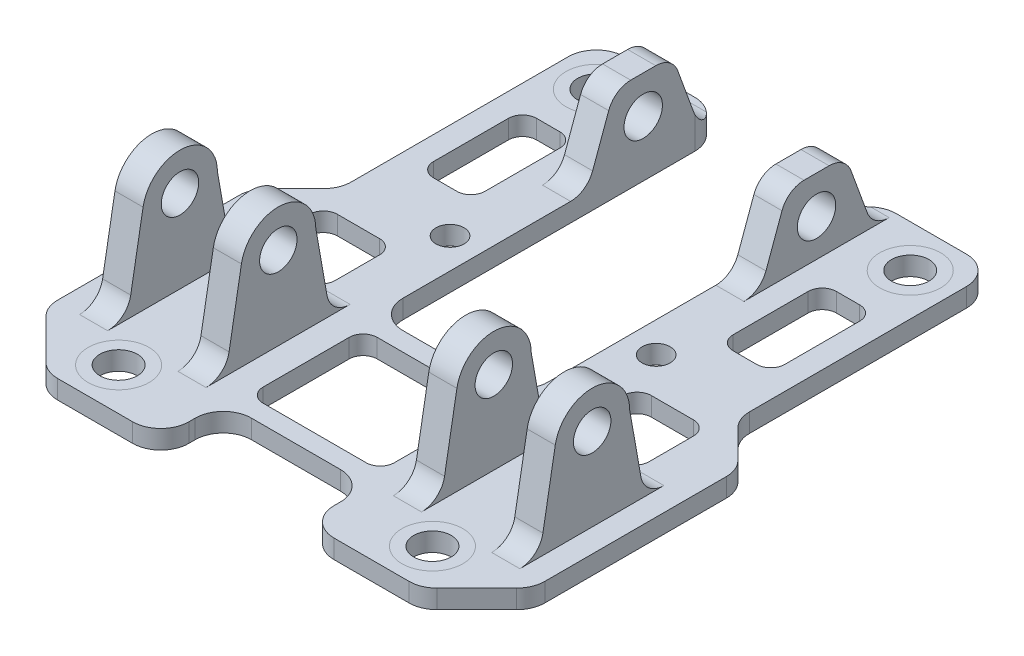
from build123d import *

# Parameters (mm, degrees)
BOSS_EXTRUDE1_DEPTH      = 52
BOSS_EXTRUDE1_DEPTH_BACK = 52
SKETCH1_W                = 120
SKETCH1_H                = 4
BOSS_EXTRUDE2_START      = -20
SKETCH1_3_R              = 4
BOSS_EXTRUDE2_DEPTH      = 6
LPATTERN1_COUNT          = 2
LPATTERN1_PITCH          = 21
BOSS_EXTRUDE3_START      = -15.5
SKETCH1_4_R              = 4.1
BOSS_EXTRUDE3_DEPTH      = 6
SKETCH2_R                = 4
SKETCH2_W                = 15.5
SKETCH2_H                = 74.282546786
SKETCH2_H_2              = 13.357231507
CUT_EXTRUDE1_DEPTH       = 96.858544882
MIRROR2_START            = -20
MIRROR2_COPY_1_SKETCH_R  = 4
MIRROR2_COPY_1_DEPTH     = 6
SKETCH4_R                = 3
CUT_EXTRUDE2_DEPTH       = 10
SKETCH5_W                = 15
SKETCH5_H                = 15.5
SKETCH5_W_2              = 11
SKETCH5_H_2              = 22
SKETCH5_W_3              = 28
SKETCH5_H_3              = 24.360221707
CUT_EXTRUDE3_DEPTH       = 10
FILLET1_R                = 6
FILLET2_R                = 3
FILLET3_R                = 5


with BuildPart() as part:
    # Sketch1 → Boss-Extrude1 (new, two sides: drawn at the far end of the back side and taken through both)
    with BuildSketch(Plane(origin=(0, 0, 0), x_dir=(0, 0, -1), z_dir=(1, 0, 0)).offset(-BOSS_EXTRUDE1_DEPTH_BACK)):
        with Locations((-16.322496103, -16.524005043)):
            Rectangle(SKETCH1_W, SKETCH1_H)
    extrude(amount=BOSS_EXTRUDE1_DEPTH + BOSS_EXTRUDE1_DEPTH_BACK)

    # Sketch1<3> → Boss-Extrude2 (add)
    with BuildSketch(Plane(origin=(0, 0, 0), x_dir=(0, 0, -1), z_dir=(1, 0, 0)).offset(BOSS_EXTRUDE2_START)):
        with BuildLine():
            Line((-54.601909319, 4.550530592), (-57.965264596, -14.524005043))
            Line((-57.965264596, -14.524005043), (-35.605042889, -14.524005043))
            Line((-35.605042889, -14.524005043), (-38.723447295, 3.161345171))
            ThreePointArc((-38.723447295, 3.161345171), (-46.026201353, 11.130902756), (-54.601909319, 4.550530592))
        make_face()
        with Locations((-46.723447295, 3.161345171)):
            Circle(SKETCH1_3_R, mode=Mode.SUBTRACT)
    boss_extrude2 = extrude(amount=-BOSS_EXTRUDE2_DEPTH)

    # LPattern1: Boss-Extrude2 ×2
    with Locations(*[(-i * LPATTERN1_PITCH, 0, 0) for i in range(1, LPATTERN1_COUNT)]):
        add(boss_extrude2)

    # Sketch1<4> → Boss-Extrude3 (add)
    with BuildSketch(Plane(origin=(0, 0, 0), x_dir=(0, 0, -1), z_dir=(1, 0, 0)).offset(BOSS_EXTRUDE3_START)):
        Polygon((14.677503897, -14.524005043), (20.501027646, 1.475994957), (32.853980149, 1.475994957), (38.677503897, -14.524005043), align=None)
        with Locations((26.677503897, -6.524005043)):
            Circle(SKETCH1_4_R, mode=Mode.SUBTRACT)
    boss_extrude3 = extrude(amount=-BOSS_EXTRUDE3_DEPTH)

    # Sketch2 → Cut-Extrude1 (cut, through all)
    with BuildSketch(Plane(origin=(0, -14.524005043, 0), x_dir=(1, 0, 0), z_dir=(0, 1, 0))):
        with Locations((-33.5, -67.322496103)):
            Circle(SKETCH2_R)
        with Locations((-33.5, 34.677503897)):
            Circle(SKETCH2_R)
        Polygon((-52, -76.322496103), (-40, -76.322496103), (-52, -64.322496103), align=None)
        Polygon((-42.5, 43.677503897), (-42.5, -11.105042889), (-52, -20.605042889), (-52, 43.677503897), align=None)
        with Locations((-7.75, 6.536230504)):
            Rectangle(SKETCH2_W, SKETCH2_H)
        with Locations((-7.75, -69.64388035)):
            Rectangle(SKETCH2_W, SKETCH2_H_2)
    cut_extrude1 = extrude(amount=-CUT_EXTRUDE1_DEPTH, mode=Mode.SUBTRACT)

    # Mirror2: Boss-Extrude2, Boss-Extrude3, Cut-Extrude1 across plane
    add(boss_extrude2.mirror(Plane(origin=(0, 0, 0), x_dir=(0, 0, 1), z_dir=(1, 0, 0))))
    add(boss_extrude3.mirror(Plane(origin=(0, 0, 0), x_dir=(0, 0, 1), z_dir=(1, 0, 0))))
    add(cut_extrude1.mirror(Plane(origin=(0, 0, 0), x_dir=(0, 0, 1), z_dir=(1, 0, 0))), mode=Mode.SUBTRACT)

    # Mirror2 copy 1 sketch → Mirror2 copy 1 (add)
    with BuildSketch(Plane(origin=(21, 0, 0), x_dir=(0, 0, -1), z_dir=(-1, 0, 0)).offset(MIRROR2_START)):
        with BuildLine():
            Line((-54.601909319, -4.550530592), (-57.965264596, 14.524005043))
            Line((-57.965264596, 14.524005043), (-35.605042889, 14.524005043))
            Line((-35.605042889, 14.524005043), (-38.723447295, -3.161345171))
            ThreePointArc((-38.723447295, -3.161345171), (-46.026201353, -11.130902756), (-54.601909319, -4.550530592))
        make_face()
        with Locations((-46.723447295, -3.161345171)):
            Circle(MIRROR2_COPY_1_SKETCH_R, mode=Mode.SUBTRACT)
    extrude(amount=-MIRROR2_COPY_1_DEPTH)

    # Sketch4 → Cut-Extrude2 (cut)
    with BuildSketch(Plane(origin=(0, -14.524005043, 0), x_dir=(1, 0, 0), z_dir=(0, 1, 0))):
        with Locations((22, -8.064569544)):
            Circle(SKETCH4_R)
        with Locations((-22, -8.064569544)):
            Circle(SKETCH4_R)
    extrude(amount=-CUT_EXTRUDE2_DEPTH, mode=Mode.SUBTRACT)

    # Sketch5 → Cut-Extrude3 (cut)
    with BuildSketch(Plane(origin=(0, -14.524005043, 0), x_dir=(1, 0, 0), z_dir=(0, 1, 0))):
        with Locations((-33.5, -23.855042889)):
            Rectangle(SKETCH5_W, SKETCH5_H)
        with Locations((-32, 11.894957111)):
            Rectangle(SKETCH5_W_2, SKETCH5_H_2)
        with Locations((0, -46.785153743)):
            Rectangle(SKETCH5_W_3, SKETCH5_H_3)
        with Locations((33.5, -23.855042889)):
            Rectangle(SKETCH5_W, SKETCH5_H)
        with Locations((32, 11.894957111)):
            Rectangle(SKETCH5_W_2, SKETCH5_H_2)
    extrude(amount=-CUT_EXTRUDE3_DEPTH, mode=Mode.SUBTRACT)

    # Fillet1
    fillet1_edges = [part.edges().sort_by_distance(p)[0] for p in [
        (40, -16.524005043, 76.322496103),
        (52, -16.524005043, 64.322496103),
        (52, -16.524005043, 20.605042889),
        (42.5, -16.524005043, 11.105042889),
        (42.5, -16.524005043, -43.677503897),
        (15.5, -16.524005043, -43.677503897),
        (-15.5, -16.524005043, -43.677503897),
        (-42.5, -16.524005043, -43.677503897),
        (-42.5, -16.524005043, 11.105042889),
        (-52, -16.524005043, 20.605042889),
        (-52, -16.524005043, 64.322496103),
        (-40, -16.524005043, 76.322496103),
        (15.5, -16.524005043, 76.322496103),
        (-15.5, -16.524005043, 76.322496103),
        (15.5, -16.524005043, 62.965264596),
        (-15.5, -16.524005043, 62.965264596),
        (-15.5, -16.524005043, 30.605042889),
        (15.5, -16.524005043, 30.605042889),
    ]]
    fillet(fillet1_edges, radius=FILLET1_R)

    # Fillet2
    fillet2_edges = [part.edges().sort_by_distance(p)[0] for p in [
        (-37.5, -16.524005043, -22.894957111),
        (-26.5, -16.524005043, -22.894957111),
        (-26.5, -16.524005043, -0.894957111),
        (-37.5, -16.524005043, -0.894957111),
        (-41, -16.524005043, 31.605042889),
        (-26, -16.524005043, 31.605042889),
        (-41, -16.524005043, 16.105042889),
        (-26, -16.524005043, 16.105042889),
        (37.5, -16.524005043, -22.894957111),
        (26.5, -16.524005043, -22.894957111),
        (37.5, -16.524005043, -0.894957111),
        (26.5, -16.524005043, -0.894957111),
        (41, -16.524005043, 16.105042889),
        (26, -16.524005043, 16.105042889),
        (26, -16.524005043, 31.605042889),
        (41, -16.524005043, 31.605042889),
        (14, -16.524005043, 58.965264596),
        (14, -16.524005043, 34.605042889),
        (-14, -16.524005043, 34.605042889),
        (-14, -16.524005043, 58.965264596),
    ]]
    fillet(fillet2_edges, radius=FILLET2_R)

    # Fillet3
    fillet3_edges = [part.edges().sort_by_distance(p)[0] for p in [
        (-44, -14.524005043, 57.965264596),
        (-23, -14.524005043, 57.965264596),
        (23, -14.524005043, 57.965264596),
        (44, -14.524005043, 57.965264596),
        (-44, -14.524005043, 35.605042889),
        (-23, -14.524005043, 35.605042889),
        (23, -14.524005043, 35.605042889),
        (44, -14.524005043, 35.605042889),
        (-18.5, 1.475994957, -20.501027646),
        (-18.5, -14.524005043, -14.677503897),
        (-18.5, 1.475994957, -32.853980149),
        (-18.541960108, -14.524005043, -38.677503897),
        (18.541960108, -14.524005043, -38.677503897),
        (18.5, 1.475994957, -32.853980149),
        (18.5, 1.475994957, -20.501027646),
        (18.5, -14.524005043, -14.677503897),
    ]]
    fillet(fillet3_edges, radius=FILLET3_R)


solid = part.part
